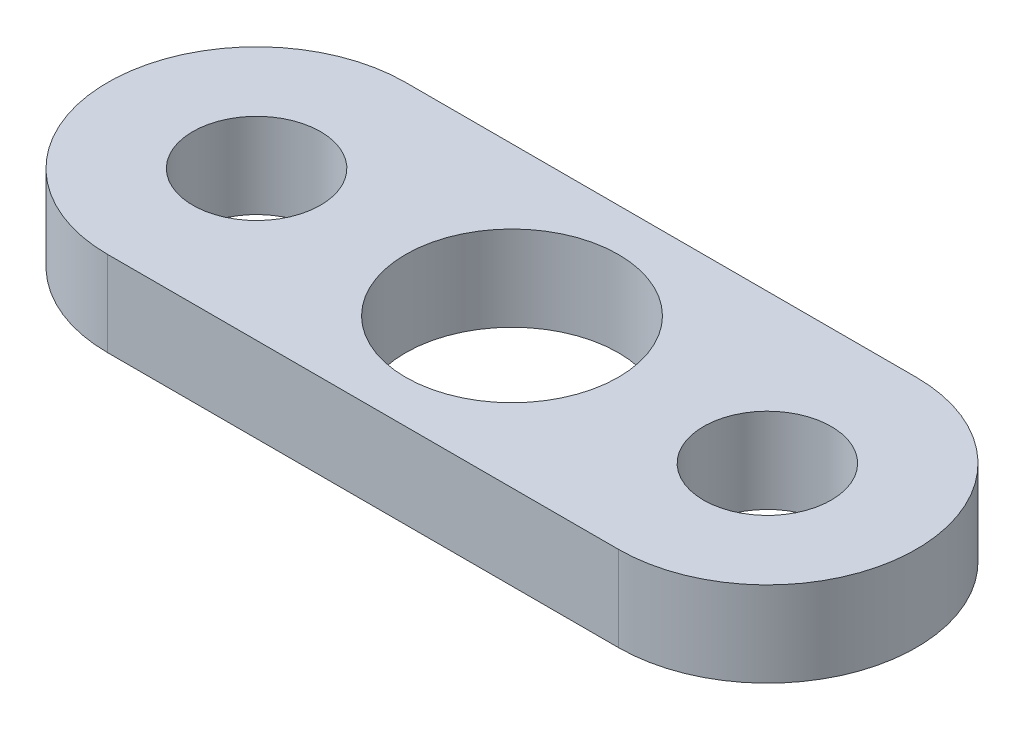
from build123d import *

# Parameters (mm, degrees)
SZKIC1_R                    = 1.5
SZKIC1_R_2                  = 2.5
DODANIE_WYCI_GNI_CIE1_DEPTH = 2


with BuildPart() as part:
    # Szkic1 → Dodanie-wyciągnięcie1 (new body)
    with BuildSketch(Plane(origin=(0, 0, 0), x_dir=(1, 0, 0), z_dir=(0, 1, 0))):
        with BuildLine():
            Line((-6, 3.5), (6, 3.5))
            ThreePointArc((6, 3.5), (9.5, 0), (6, -3.5))
            Line((6, -3.5), (-6, -3.5))
            ThreePointArc((-6, -3.5), (-9.5, 0), (-6, 3.5))
        make_face()
        with Locations(Location((6, 0, 0), (0, 0, 270))):
            Circle(SZKIC1_R, mode=Mode.SUBTRACT)
        with Locations(Location((-6, 0, 0), (0, 0, 90))):
            Circle(SZKIC1_R, mode=Mode.SUBTRACT)
        with Locations(Location((0, 0, 0), (0, 0, 270))):
            Circle(SZKIC1_R_2, mode=Mode.SUBTRACT)
    extrude(amount=DODANIE_WYCI_GNI_CIE1_DEPTH)


solid = part.part
